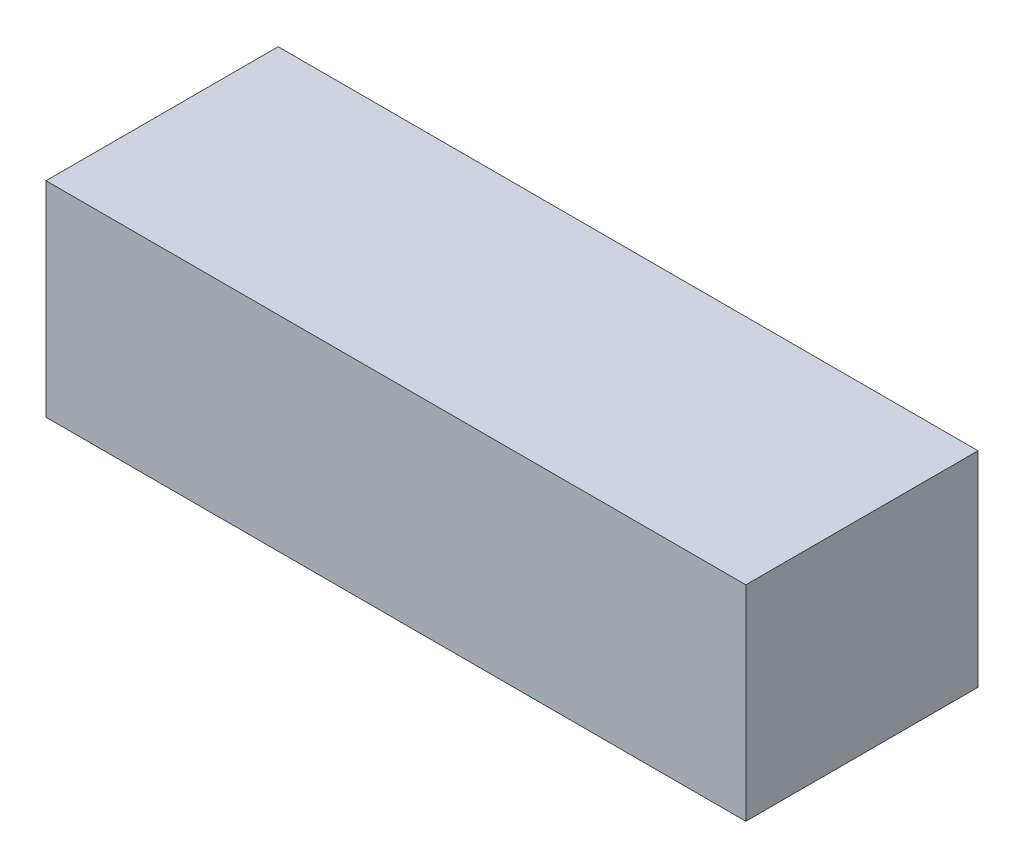
from build123d import *

# Parameters (mm, degrees)
SKETCH_1_W      = 102.5
SKETCH_1_H      = 34
EXTRUDE_1_DEPTH = 30


with BuildPart() as part:
    # 草图1 → 凸台-拉伸1 (new body)
    with BuildSketch(Plane(origin=(0, 0, 0), x_dir=(1, 0, 0), z_dir=(0, 1, 0))):
        Rectangle(SKETCH_1_W, SKETCH_1_H)
    extrude(amount=EXTRUDE_1_DEPTH)


solid = part.part
